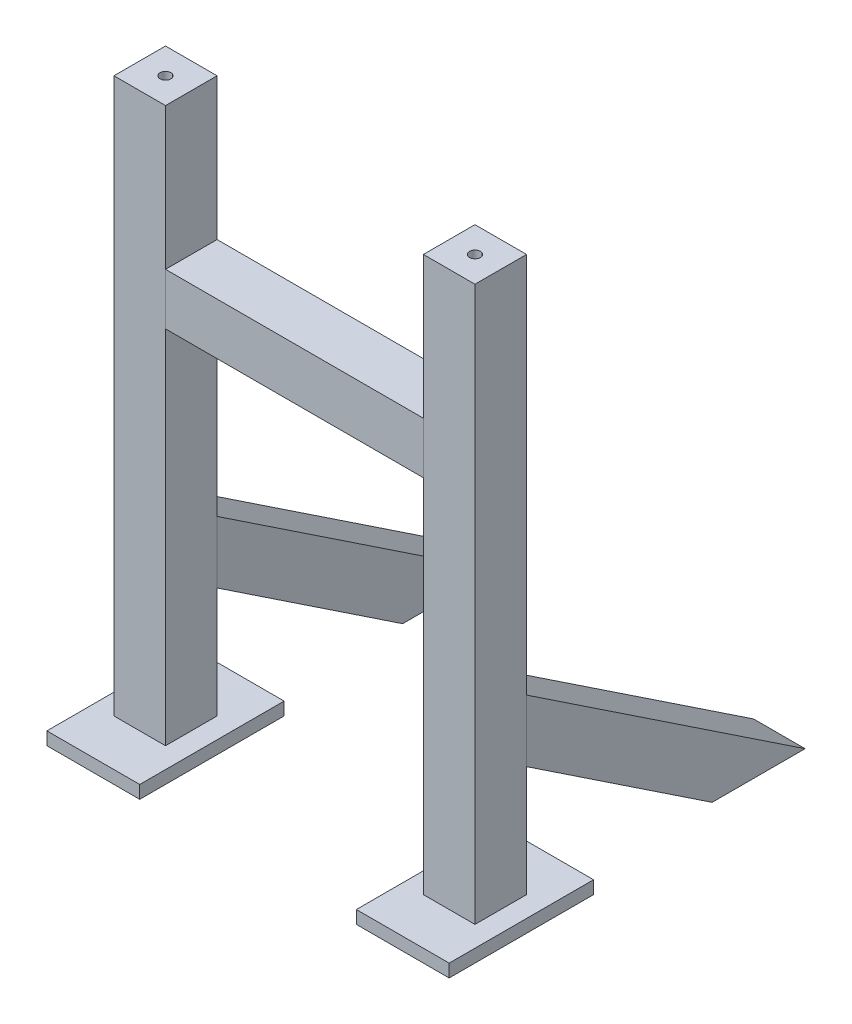
from build123d import *

# Parameters (mm, degrees)
SK_FOOTPLATES_W       = 36
SK_FOOTPLATES_H       = 56
EX_FOOTPLATES_DEPTH   = 5
EX_FOOTPLATES_2_DEPTH = 5
SK_POSTS_W            = 20
SK_POSTS_H            = 20
SK_POSTS_R            = 2.1
EX_POSTS_DEPTH        = 215
EX_POSTS_2_DEPTH      = 215
SK_BRACE_W            = 20
SK_BRACE_H            = 20
SK_BRACE_R            = 2.1
EX_BRACE_DEPTH        = 100
EX_STRUTL_DEPTH       = 20
EX_STRUTR_DEPTH       = 20


with BuildPart() as part:
    # SK_FootPlates → EX_FootPlates (new body)
    with BuildSketch(Plane(origin=(0, 0, 0), x_dir=(1, 0, 0), z_dir=(0, 1, 0))):
        with Locations((60, 0)):
            Rectangle(SK_FOOTPLATES_W, SK_FOOTPLATES_H)
    extrude(amount=EX_FOOTPLATES_DEPTH)


with BuildPart() as body_2:
    # SK_FootPlates → EX_FootPlates 2 (new body)
    with BuildSketch(Plane(origin=(0, 0, 0), x_dir=(1, 0, 0), z_dir=(0, 1, 0))):
        with Locations((-60, 0)):
            Rectangle(SK_FOOTPLATES_W, SK_FOOTPLATES_H)
    extrude(amount=EX_FOOTPLATES_2_DEPTH)


with BuildPart() as body_3:
    # SK_Posts → EX_Posts (new body)
    with BuildSketch(Plane(origin=(0, 5, 0), x_dir=(1, 0, 0), z_dir=(0, 1, 0))):
        with Locations((60, 0)):
            Rectangle(SK_POSTS_W, SK_POSTS_H)
        with Locations((60, 0)):
            Circle(SK_POSTS_R, mode=Mode.SUBTRACT)
    extrude(amount=EX_POSTS_DEPTH)


with BuildPart() as body_4:
    # SK_Posts → EX_Posts 2 (new body)
    with BuildSketch(Plane(origin=(0, 5, 0), x_dir=(1, 0, 0), z_dir=(0, 1, 0))):
        with Locations((-60, 0)):
            Rectangle(SK_POSTS_W, SK_POSTS_H)
        with Locations((-60, 0)):
            Circle(SK_POSTS_R, mode=Mode.SUBTRACT)
    extrude(amount=EX_POSTS_2_DEPTH)


with BuildPart() as body_5:
    # SK_Brace → EX_Brace (new body)
    with BuildSketch(Plane(origin=(-50, 0, 0), x_dir=(0, 0, -1), z_dir=(1, 0, 0))):
        with Locations((0, 155)):
            Rectangle(SK_BRACE_W, SK_BRACE_H)
        with Locations((0, 155)):
            Circle(SK_BRACE_R, mode=Mode.SUBTRACT)
    extrude(amount=EX_BRACE_DEPTH)


with BuildPart() as body_6:
    # SK_StrutL → EX_StrutL (new body)
    with BuildSketch(Plane(origin=(50, 0, 0), x_dir=(0, 0, -1), z_dir=(1, 0, 0))):
        Polygon((118.027756377, 0), (81.972243623, 0), (10, 47.981495748), (10, 72.018504252), align=None)
    extrude(amount=EX_STRUTL_DEPTH)


with BuildPart() as body_7:
    # SK_StrutR → EX_StrutR (new body)
    with BuildSketch(Plane(origin=(-70, 0, 0), x_dir=(0, 0, -1), z_dir=(1, 0, 0))):
        Polygon((118.027756377, 0), (81.972243623, 0), (10, 47.981495748), (10, 72.018504252), align=None)
    extrude(amount=EX_STRUTR_DEPTH)


solid = Compound([part.part, body_2.part, body_3.part, body_4.part, body_5.part, body_6.part, body_7.part])
